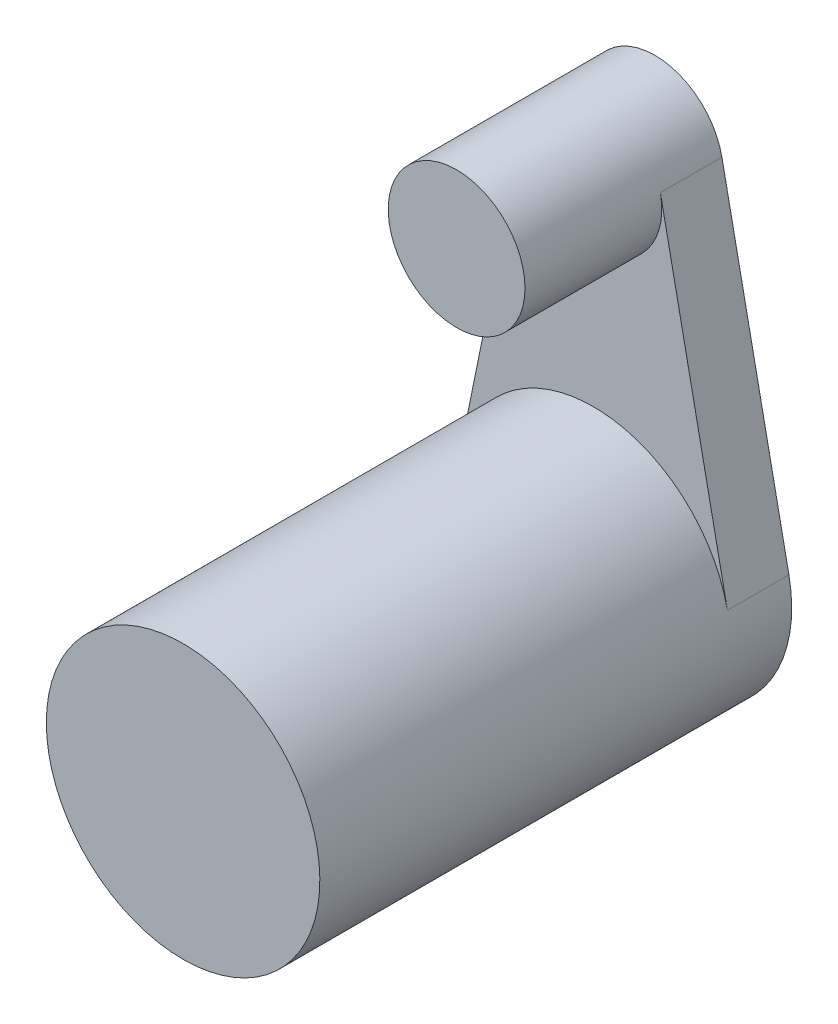
from build123d import *

# Parameters (mm, degrees)
SKETCH_1_R      = 1
EXTRUDE_1_DEPTH = 2
SKETCH_2_R      = 2
EXTRUDE_2_DEPTH = 6
EXTRUDE_START   = 0.9
SKETCH_3_R      = 1
SKETCH_3_R_2    = 2
EXTRUDE_3_DEPTH = 0.9


with BuildPart() as part:
    # 스케치1 → 보스-돌출1 (new body)
    with BuildSketch(Plane.XY):
        Circle(SKETCH_1_R)
    extrude(amount=EXTRUDE_1_DEPTH)



with BuildPart() as body_2:
    # 스케치2 → 보스-돌출2 (new body)
    with BuildSketch(Plane(origin=(0, 0, 0), x_dir=(-1, 0, 0), z_dir=(0, 0, -1))):
        with Locations((0, -5)):
            Circle(SKETCH_2_R)
    extrude(amount=-EXTRUDE_2_DEPTH)


with BuildPart() as part_1:
    add(part.part)

    add(body_2.part)  # 보스-돌출3 merges body 2
    # 스케치3 → 보스-돌출3 (add)
    with BuildSketch(Plane(origin=(0, 0, 0), x_dir=(-1, 0, 0), z_dir=(0, 0, -1)).offset(EXTRUDE_START)):
        with Locations(Location((0, 0, 0), (0, 0, 11.536959033))):
            Circle(SKETCH_3_R)
        with BuildLine():
            Line((1.959591794, -4.6), (0.979795897, 0.2))
            ThreePointArc((0.979795897, 0.2), (0.994936153, 0.100508962), (1, 0))
            ThreePointArc((1, 0), (-0.100508962, -0.994936153), (-0.979795897, 0.2))
            Line((-0.979795897, 0.2), (-1.959591794, -4.6))
            ThreePointArc((-1.959591794, -4.6), (0, -3), (1.959591794, -4.6))
        make_face()
        with Locations(Location((0, -5, 0), (0, 0, 168.463040967))):
            Circle(SKETCH_3_R_2)
    extrude(amount=-EXTRUDE_3_DEPTH)


solid = part_1.part
